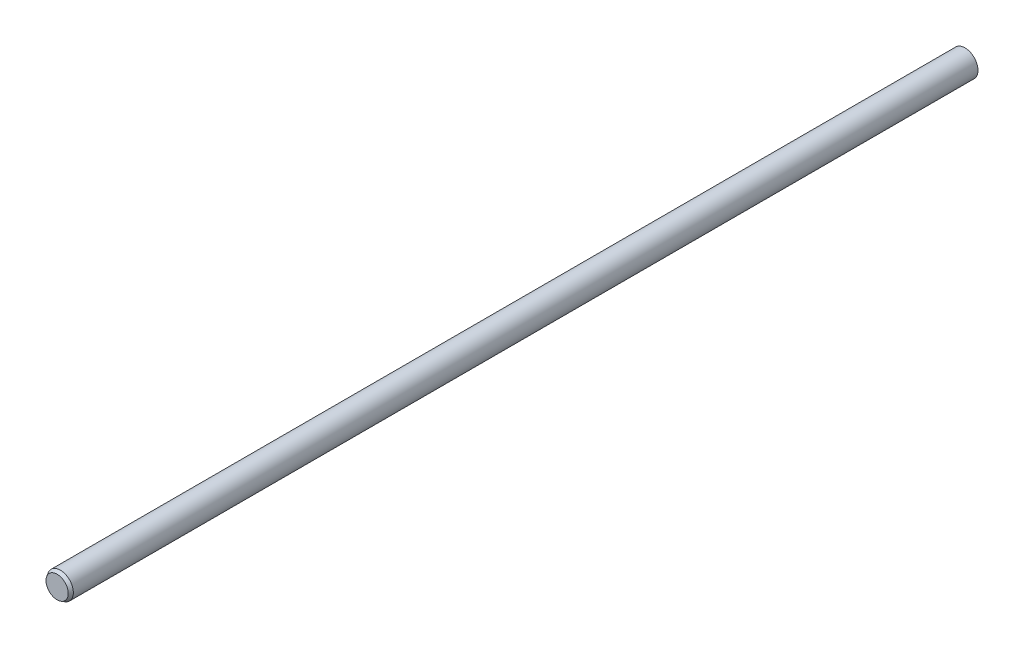
from build123d import *
from OCP.BRepFilletAPI import BRepFilletAPI_MakeChamfer

# Parameters (mm, degrees)
SKETCH1_R           = 4
BOSS_EXTRUDE1_DEPTH = 280
CHAMFER1_SIZE       = 1
CHAMFER1_SIZE2      = 0.577350269


with BuildPart() as part:
    # Sketch1 → Boss-Extrude1 (new body)
    with BuildSketch(Plane.XY):
        Circle(SKETCH1_R)
    extrude(amount=BOSS_EXTRUDE1_DEPTH)

    # Chamfer1: one chamfer whose edges measure the first distance from different faces: ONE call of the kernel's chamfer builder (chamfer() names one face for all edges)
    chamfer1_edges_1 = [part.edges().sort_by_distance(p)[0] for p in [
        (-4, 0, 0),
    ]]
    chamfer1_side_1 = [part.faces().sort_by_distance(p)[0] for p in [
        (0, 0, 0),
    ]]
    chamfer1_edges_2 = [part.edges().sort_by_distance(p)[0] for p in [
        (-4, 0, 280),
    ]]
    chamfer1_side_2 = [part.faces().sort_by_distance(p)[0] for p in [
        (-4, 0, 140),
    ]]
    chamfer1 = BRepFilletAPI_MakeChamfer(part.part.solid().wrapped)
    for e in chamfer1_edges_1:
        chamfer1.Add(CHAMFER1_SIZE, CHAMFER1_SIZE2, e.wrapped, chamfer1_side_1[0].wrapped)  # the first distance lies on this face
    for e in chamfer1_edges_2:
        chamfer1.Add(CHAMFER1_SIZE, CHAMFER1_SIZE2, e.wrapped, chamfer1_side_2[0].wrapped)  # the first distance lies on this face
    add(Compound.cast(chamfer1.Shape()), mode=Mode.REPLACE)


solid = part.part
